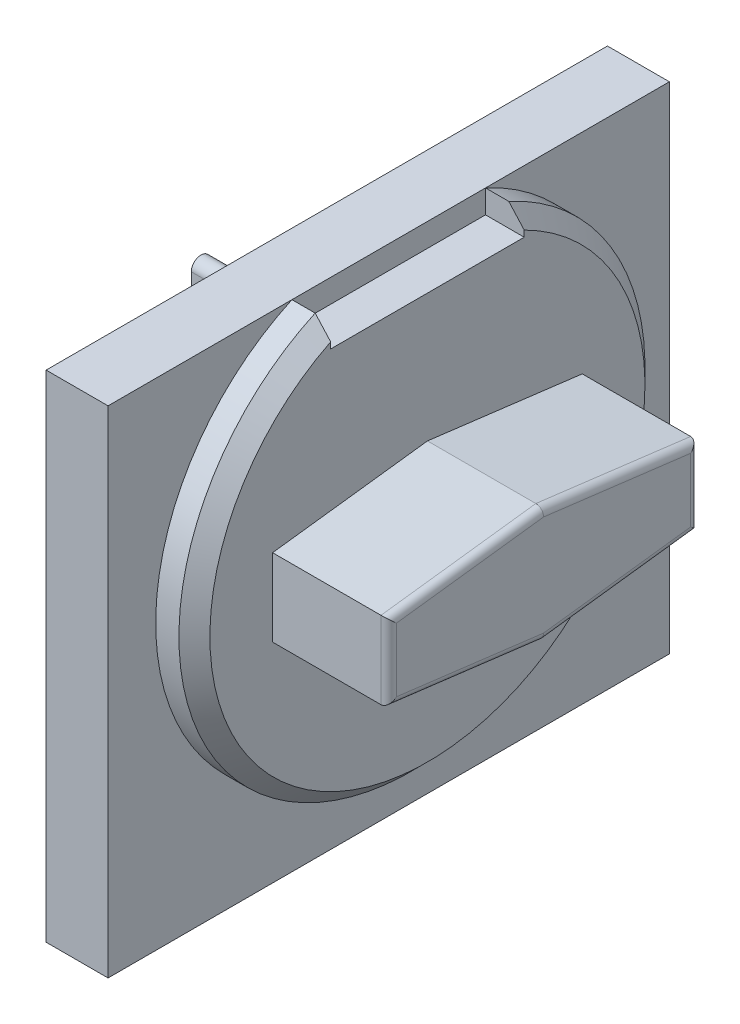
from build123d import *

# Parameters (mm, degrees)
BOSS_EXTRUDE1_DEPTH = 19.05
SKETCH2_R           = 38.222793673
BOSS_EXTRUDE2_DEPTH = 6.35
SKETCH3_W           = 31.75
SKETCH3_H           = 13.333086578
CUT_EXTRUDE1_DEPTH  = 6.35
SKETCH4_W           = 92.075
SKETCH4_H           = 81.28
BOSS_EXTRUDE3_DEPTH = 10.16
CHAMFER1_SIZE       = 2.54
FILLET1_R           = 1.27
SKETCH5_R           = 3.175
BOSS_EXTRUDE4_DEPTH = 15.875
BOSS_EXTRUDE5_DEPTH = 4.7625


with BuildPart() as part:
    # Sketch1 → Boss-Extrude1 (new body)
    with BuildSketch(Plane(origin=(0, 0, 0), x_dir=(0, 0, -1), z_dir=(1, 0, 0))):
        Polygon((-25.4, -5.93604562), (-25.4, 6.76395438), (0, 9.93895438), (25.4, 6.76395438), (25.4, -5.93604562), (0, -9.11104562), align=None)
    extrude(amount=-BOSS_EXTRUDE1_DEPTH)

    # Sketch2 → Boss-Extrude2 (add)
    with BuildSketch(Plane.ZY.offset(19.05)):
        with Locations(Location((0, 0, 0), (0, 0, 180))):
            Circle(SKETCH2_R)
    extrude(amount=BOSS_EXTRUDE2_DEPTH)

    # Sketch3 → Cut-Extrude1 (cut)
    with BuildSketch(Plane(origin=(-19.05, 0, 0), x_dir=(0, 0, -1), z_dir=(1, 0, 0))):
        with Locations((0, 37.6091503)):
            Rectangle(SKETCH3_W, SKETCH3_H)
    extrude(amount=-CUT_EXTRUDE1_DEPTH, mode=Mode.SUBTRACT)

    # Sketch4 → Boss-Extrude3 (add)
    with BuildSketch(Plane.ZY.offset(25.4)):
        with Locations((0, -5.869806857)):
            Rectangle(SKETCH4_W, SKETCH4_H)
    extrude(amount=BOSS_EXTRUDE3_DEPTH)

    # Chamfer1
    chamfer1_edges = [part.edges().sort_by_distance(p)[0] for p in [
        (-19.05, -38.222793673, 0),
    ]]
    chamfer(chamfer1_edges, length=CHAMFER1_SIZE)

    # Fillet1
    fillet1_edges = [part.edges().sort_by_distance(p)[0] for p in [
        (0, 0.41395438, 25.4),
        (0, 8.35145438, 12.7),
        (0, 8.35145438, -12.7),
        (0, 0.41395438, -25.4),
        (0, -7.52354562, -12.7),
        (0, -7.52354562, 12.7),
    ]]
    fillet(fillet1_edges, radius=FILLET1_R)

    # Sketch5 → Boss-Extrude4 (add)
    with BuildSketch(Plane.ZY.offset(35.56)):
        Circle(SKETCH5_R)
    extrude(amount=BOSS_EXTRUDE4_DEPTH)

    # Sketch6 → Boss-Extrude5 (add)
    with BuildSketch(Plane.ZY.offset(51.435)):
        with BuildLine():
            Line((11.624433923, 11.383749315), (7.542732602, 6.519367101))
            ThreePointArc((7.542732602, 6.519367101), (7.34328288, 4.239646347), (9.417303827, 3.272514497))
            Line((9.417303827, 3.272514497), (15.670833059, 4.375180425))
            ThreePointArc((15.670833059, 4.375180425), (17.509881849, 3.087464599), (16.222166023, 1.248415809))
            Line((16.222166023, 1.248415809), (9.968636791, 0.145749881))
            ThreePointArc((9.968636791, 0.145749881), (8.350473186, -1.472413724), (9.317605037, -3.546434671))
            Line((9.317605037, -3.546434671), (14.816866351, -6.721434671))
            ThreePointArc((14.816866351, -6.721434671), (15.397931679, -8.89), (13.229366351, -9.471065329))
            Line((13.229366351, -9.471065329), (7.730105037, -6.296065329))
            ThreePointArc((7.730105037, -6.296065329), (5.450384283, -6.49551505), (4.858095296, -8.705967643))
            Line((4.858095296, -8.705967643), (7.029923206, -14.673015785))
            ThreePointArc((7.029923206, -14.673015785), (6.081118148, -16.707734798), (4.046399135, -15.75892974))
            Line((4.046399135, -15.75892974), (1.874571225, -9.791881598))
            ThreePointArc((1.874571225, -9.791881598), (0, -8.479292695), (-1.874571225, -9.791881598))
            Line((-1.874571225, -9.791881598), (-4.046399135, -15.75892974))
            ThreePointArc((-4.046399135, -15.75892974), (-6.081118148, -16.707734798), (-7.029923206, -14.673015785))
            Line((-7.029923206, -14.673015785), (-4.858095296, -8.705967643))
            ThreePointArc((-4.858095296, -8.705967643), (-5.450384283, -6.49551505), (-7.730105037, -6.296065329))
            Line((-7.730105037, -6.296065329), (-13.229366351, -9.471065329))
            ThreePointArc((-13.229366351, -9.471065329), (-15.397931679, -8.89), (-14.816866351, -6.721434671))
            Line((-14.816866351, -6.721434671), (-9.317605037, -3.546434671))
            ThreePointArc((-9.317605037, -3.546434671), (-8.350473186, -1.472413724), (-9.968636791, 0.145749881))
            Line((-9.968636791, 0.145749881), (-16.222166023, 1.248415809))
            ThreePointArc((-16.222166023, 1.248415809), (-17.509881849, 3.087464599), (-15.670833059, 4.375180425))
            Line((-15.670833059, 4.375180425), (-9.417303827, 3.272514497))
            ThreePointArc((-9.417303827, 3.272514497), (-7.34328288, 4.239646347), (-7.542732602, 6.519367101))
            Line((-7.542732602, 6.519367101), (-11.624433923, 11.383749315))
            ThreePointArc((-11.624433923, 11.383749315), (-11.4287637, 13.620270199), (-9.192242816, 13.424599976))
            Line((-9.192242816, 13.424599976), (-5.110541495, 8.560217762))
            ThreePointArc((-5.110541495, 8.560217762), (-2.900088903, 7.967928775), (-1.5875, 9.8425))
            Line((-1.5875, 9.8425), (-1.5875, 16.1925))
            ThreePointArc((-1.5875, 16.1925), (0, 17.78), (1.5875, 16.1925))
            Line((1.5875, 16.1925), (1.5875, 9.8425))
            ThreePointArc((1.5875, 9.8425), (2.900088903, 7.967928775), (5.110541495, 8.560217762))
            Line((5.110541495, 8.560217762), (9.192242816, 13.424599976))
            ThreePointArc((9.192242816, 13.424599976), (11.4287637, 13.620270199), (11.624433923, 11.383749315))
        make_face()
    extrude(amount=BOSS_EXTRUDE5_DEPTH)


solid = part.part
